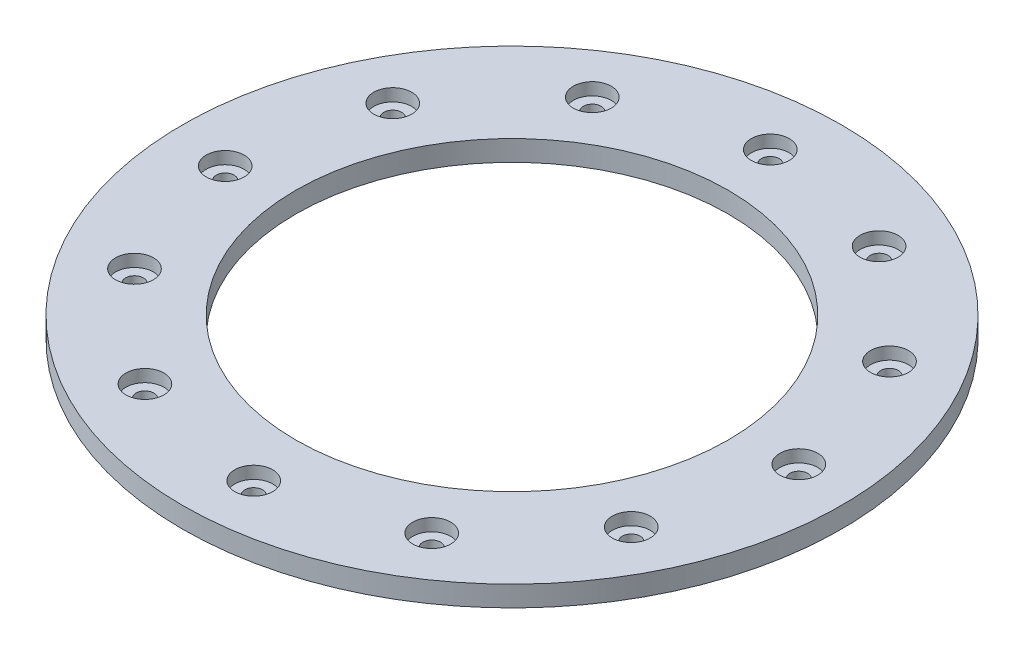
from build123d import *

# Parameters (mm, degrees)
SKETCH1_R                                        = 101.6
SKETCH1_R_2                                      = 66.675
SKETCH1_R_3                                      = 0.254
BOSS_EXTRUDE1_DEPTH                              = 6.35
CBORE_FOR_M5_HEX_HEAD_MACHINE_SCREW1_D           = 5.5
CBORE_FOR_M5_HEX_HEAD_MACHINE_SCREW1_CBORE_D     = 11.71
CBORE_FOR_M5_HEX_HEAD_MACHINE_SCREW1_CBORE_DEPTH = 3.8
CIRPATTERN1_COUNT                                = 12


with BuildPart() as part:
    # Sketch1 → Boss-Extrude1 (new body)
    with BuildSketch(Plane(origin=(0, 0, 0), x_dir=(1, 0, 0), z_dir=(0, 1, 0))):
        with Locations(Location((0, 0, 0), (0, 0, 270))):
            Circle(SKETCH1_R)
        with Locations(Location((0, 0, 0), (0, 0, 270))):
            Circle(SKETCH1_R_2, mode=Mode.SUBTRACT)
        with Locations(Location((-74.964980341, 38.201709762, 0), (0, 0, 270))):
            Circle(SKETCH1_R_3, mode=Mode.SUBTRACT)
    extrude(amount=BOSS_EXTRUDE1_DEPTH)

    # CBORE for M5 Hex Head Machine Screw1 (through all)
    with Locations(Plane(origin=(0, 6.35, 0), x_dir=(1, 0, 0), z_dir=(0, 1, 0))):
        with Locations((-74.964980341, 38.201709762)):
            cbore_for_m5_hex_head_machine_screw1 = CounterBoreHole(CBORE_FOR_M5_HEX_HEAD_MACHINE_SCREW1_D / 2, CBORE_FOR_M5_HEX_HEAD_MACHINE_SCREW1_CBORE_D / 2, CBORE_FOR_M5_HEX_HEAD_MACHINE_SCREW1_CBORE_DEPTH)

    # CirPattern1: CBORE for M5 Hex Head Machine Screw1 ×12 about axis
    cirpattern1_axis = Axis((0, 0, 0), (0, 1, 0))
    for i in range(1, CIRPATTERN1_COUNT):
        add(cbore_for_m5_hex_head_machine_screw1.rotate(cirpattern1_axis, i * 360 / CIRPATTERN1_COUNT), mode=Mode.SUBTRACT)


solid = part.part
